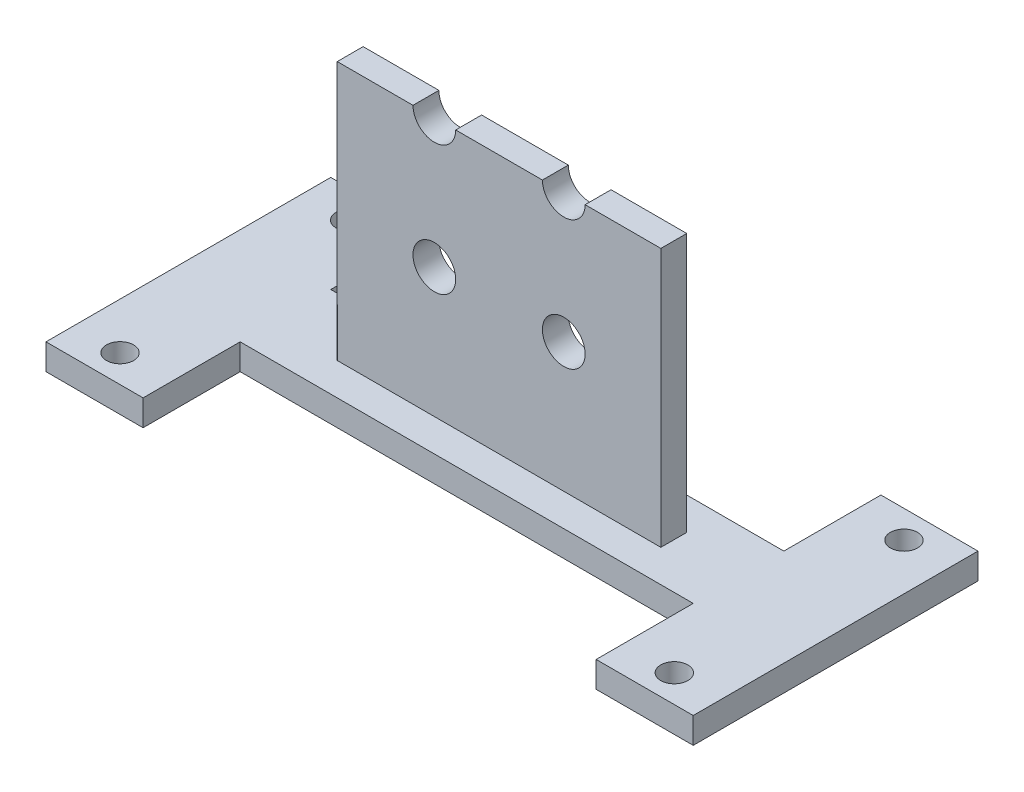
from build123d import *

# Parameters (mm, degrees)
SKETCH_1_W          = 50
SKETCH_1_H          = 22
SKETCH_1_R          = 1.05
EXTRUDE_1_DEPTH     = 2
SKETCH_2_W          = 25
SKETCH_2_H          = 2
EXTRUDE_2_DEPTH     = 20
SKETCH_3_R          = 1.65
CUT_EXTRUDE_1_DEPTH = 30
SKETCH_4_W          = 35
SKETCH_4_H          = 15
CUT_EXTRUDE_2_DEPTH = 30


with BuildPart() as part:
    # 草图1 → 凸台-拉伸1 (new body)
    with BuildSketch(Plane(origin=(0, 0, 0), x_dir=(1, 0, 0), z_dir=(0, 1, 0))):
        Rectangle(SKETCH_1_W, SKETCH_1_H)
        with Locations(Location((-21.41, 8.87, 0), (0, 0, 270))):
            Circle(SKETCH_1_R, mode=Mode.SUBTRACT)
        with Locations(Location((-21.41, -8.87, 0), (0, 0, 90))):
            Circle(SKETCH_1_R, mode=Mode.SUBTRACT)
        with Locations(Location((21.41, -8.87, 0), (0, 0, 270))):
            Circle(SKETCH_1_R, mode=Mode.SUBTRACT)
        with Locations(Location((21.41, 8.87, 0), (0, 0, 90))):
            Circle(SKETCH_1_R, mode=Mode.SUBTRACT)
    extrude(amount=EXTRUDE_1_DEPTH)

    # 草图2 → 凸台-拉伸2 (add)
    with BuildSketch(Plane(origin=(0, 2, 0), x_dir=(1, 0, 0), z_dir=(0, 1, 0))):
        Rectangle(SKETCH_2_W, SKETCH_2_H)
    extrude(amount=EXTRUDE_2_DEPTH)

    # 草图3 → 切除-拉伸1 (cut)
    with BuildSketch(Plane.XY.offset(1)):
        with Locations((-5, 22)):
            Circle(SKETCH_3_R)
        with Locations((-5, 12)):
            Circle(SKETCH_3_R)
        with Locations((5, 12)):
            Circle(SKETCH_3_R)
        with Locations((5, 22)):
            Circle(SKETCH_3_R)
    extrude(amount=-CUT_EXTRUDE_1_DEPTH, mode=Mode.SUBTRACT)

    # 草图4 → 切除-拉伸2 (cut)
    with BuildSketch(Plane(origin=(0, 2, 0), x_dir=(1, 0, 0), z_dir=(0, 1, 0))):
        with Locations((0, -11)):
            Rectangle(SKETCH_4_W, SKETCH_4_H)
        with Locations((0, 11)):
            Rectangle(SKETCH_4_W, SKETCH_4_H)
    extrude(amount=-CUT_EXTRUDE_2_DEPTH, mode=Mode.SUBTRACT)


solid = part.part
